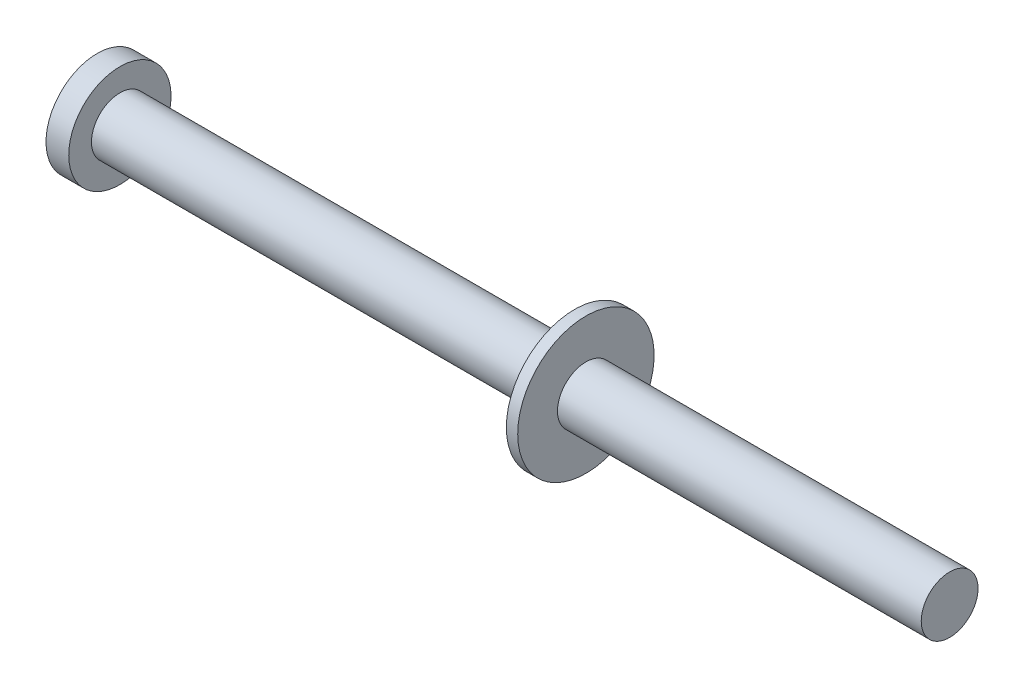
from build123d import *


with BuildPart() as part:
    # Sketch1 → Revolve1 (revolve)
    with BuildSketch(Plane(origin=(0, 0, 0), x_dir=(1, 0, 0), z_dir=(0, 1, 0)), mode=Mode.PRIVATE) as revolve1_sk:
        Polygon((-75, 0), (75, 0), (75, 5), (11, 5), (11, 12), (9, 12), (9, 5), (-71, 5), (-71, 9), (-75, 9), align=None)
    revolve(revolve1_sk.sketch.rotate(Axis((-75, 0, 0), (1, 0, 0)), 180), axis=Axis((-75, 0, 0), (1, 0, 0)))


solid = part.part
